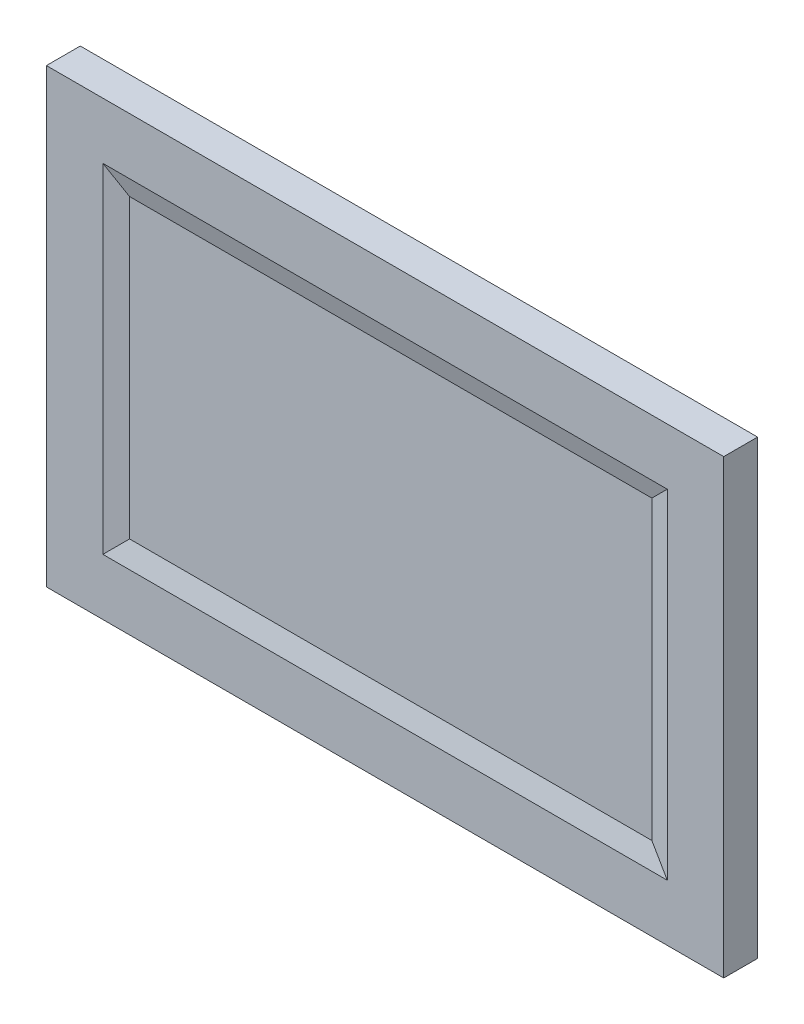
from build123d import *

# Parameters (mm, degrees)
SKETCH2_W                    = 120
SKETCH2_H                    = 80
BOSS_EXTRUDE1_DEPTH          = 3
SKETCH3_W                    = 100
SKETCH3_H                    = 60
CUT_EXTRUDE1_DEPTH           = 1
CUT_EXTRUDE1_TAPER           = 75
CUT_EXTRUDE1_OTHER_WAY_DEPTH = 1
CUT_EXTRUDE1_OTHER_WAY_DRAFT = -75
MIRROR1_COPY_1_SKETCH_W      = 100
MIRROR1_COPY_1_SKETCH_H      = 60
MIRROR1_COPY_1_DEPTH         = 1
MIRROR1_COPY_1_DRAFT         = -75
MIRROR1_COPY_2_SKETCH_W      = 100
MIRROR1_COPY_2_SKETCH_H      = 60
MIRROR1_COPY_2_DEPTH         = 1
MIRROR1_COPY_2_DRAFT         = -75
BOSS_EXTRUDE2_DEPTH          = 0.25


with BuildPart() as part:
    # Sketch2 → Boss-Extrude1 (new, symmetric)
    with BuildSketch(Plane.XY):
        Rectangle(SKETCH2_W, SKETCH2_H)
    extrude(amount=BOSS_EXTRUDE1_DEPTH, both=True)

    # Sketch3 → Cut-Extrude1 (cut)
    with BuildSketch(Plane.XY.offset(3)):
        Rectangle(SKETCH3_W, SKETCH3_H)
    cut_extrude1 = extrude(amount=CUT_EXTRUDE1_DEPTH, taper=CUT_EXTRUDE1_TAPER, mode=Mode.SUBTRACT)


with BuildPart() as cut_extrude1_other_way_tool:
    # Sketch3 → Cut-Extrude1 other way (with draft: the straight prism first)
    with BuildSketch(Plane.XY.offset(3)):
        Rectangle(SKETCH3_W, SKETCH3_H)
    extrude(amount=-CUT_EXTRUDE1_OTHER_WAY_DEPTH)
    # Cut-Extrude1 other way: the draft: its side faces are tilted about the plane it starts from
    cut_extrude1_other_way_sides = [cut_extrude1_other_way_tool.faces().sort_by_distance(p)[0] for p in [
        (-50, 0, 2.5),
        (0, -30, 2.5),
        (50, 0, 2.5),
        (0, 30, 2.5),
    ]]
    draft(cut_extrude1_other_way_sides, Plane.XY.offset(3), CUT_EXTRUDE1_OTHER_WAY_DRAFT)


with BuildPart() as part_1:
    add(part.part)

    # Cut-Extrude1 other way: cut by cut_extrude1_other_way_tool
    add(cut_extrude1_other_way_tool.part, mode=Mode.SUBTRACT)

    # Mirror1: Cut-Extrude1 across plane
    add(cut_extrude1.mirror(Plane.XY), mode=Mode.SUBTRACT)


with BuildPart() as mirror1_copy_1_tool:
    # Mirror1 copy 1 sketch → Mirror1 copy 1 (with draft: the straight prism first)
    with BuildSketch(Plane(origin=(0, 0, -3), x_dir=(1, 0, 0), z_dir=(0, 0, -1))):
        Rectangle(MIRROR1_COPY_1_SKETCH_W, MIRROR1_COPY_1_SKETCH_H)
    extrude(amount=-MIRROR1_COPY_1_DEPTH)
    # Mirror1 copy 1: the draft: its side faces are tilted about the plane it starts from
    mirror1_copy_1_sides = [mirror1_copy_1_tool.faces().sort_by_distance(p)[0] for p in [
        (-50, 0, -2.5),
        (0, -30, -2.5),
        (50, 0, -2.5),
        (0, 30, -2.5),
    ]]
    draft(mirror1_copy_1_sides, Plane(origin=(0, 0, -3), x_dir=(1, 0, 0), z_dir=(0, 0, -1)), MIRROR1_COPY_1_DRAFT)


with BuildPart() as part_2:
    add(part_1.part)

    # Mirror1 copy 1: cut by mirror1_copy_1_tool
    add(mirror1_copy_1_tool.part, mode=Mode.SUBTRACT)


with BuildPart() as mirror1_copy_2_tool:
    # Mirror1 copy 2 sketch → Mirror1 copy 2 (with draft: the straight prism first)
    with BuildSketch(Plane(origin=(0, 0, -3), x_dir=(1, 0, 0), z_dir=(0, 0, -1))):
        Rectangle(MIRROR1_COPY_2_SKETCH_W, MIRROR1_COPY_2_SKETCH_H)
    extrude(amount=-MIRROR1_COPY_2_DEPTH)
    # Mirror1 copy 2: the draft: its side faces are tilted about the plane it starts from
    mirror1_copy_2_sides = [mirror1_copy_2_tool.faces().sort_by_distance(p)[0] for p in [
        (-50, 0, -2.5),
        (0, -30, -2.5),
        (50, 0, -2.5),
        (0, 30, -2.5),
    ]]
    draft(mirror1_copy_2_sides, Plane(origin=(0, 0, -3), x_dir=(1, 0, 0), z_dir=(0, 0, -1)), MIRROR1_COPY_2_DRAFT)


with BuildPart() as part_3:
    add(part_2.part)

    # Mirror1 copy 2: cut by mirror1_copy_2_tool
    add(mirror1_copy_2_tool.part, mode=Mode.SUBTRACT)

    # Sketch4 → Boss-Extrude2 (add, symmetric)
    # profile 1 of 6: a face of its own
    with BuildSketch(Plane(origin=(0, 0, -2), x_dir=(-1, 0, 0), z_dir=(0, 0, -1))):
        Polygon((-41.003516665, -22.017655774), (-41.003516665, -18.517655774), (-40.937611216, -18.517655774), (-38.625311537, -21.272363306), (-38.625311537, -18.517655774), (-38.311208973, -18.517655774), (-38.311208973, -22.017655774), (-38.382723396, -22.017655774), (-40.689414101, -19.269258338), (-40.689414101, -22.017655774), align=None)
    # profile 2 of 6: a face of its own
    with BuildSketch(Plane(origin=(0, 0, -2), x_dir=(-1, 0, 0), z_dir=(0, 0, -1))):
        with BuildLine():
            add(Edge.make_bspline(
                [(-36.268140062, -19.415091671), (-36.22014879, -19.416113563), (-36.126049632, -19.418117241), (-35.988241746, -19.439532207), (-35.85669661, -19.472279571), (-35.730910418, -19.517551133), (-35.612494123, -19.578233084), (-35.499722878, -19.650642375), (-35.39290587, -19.736424969), (-35.32888284, -19.802783037), (-35.296385255, -19.83646587)],
                knots=[0, 0, 0, 0, 1.054011418, 2.066658804, 3.057071809, 4.030435133, 4.997543892, 5.974964718, 6.972108034, 8, 8, 8, 8], degree=3))
            add(Edge.make_bspline(
                [(-35.296385255, -19.83646587), (-35.268403301, -19.868679856), (-35.21298092, -19.932484398), (-35.141915202, -20.035940011), (-35.080693641, -20.143080112), (-35.03163068, -20.255327438), (-34.992945657, -20.37170211), (-34.965479961, -20.492604121), (-34.949143026, -20.617766468), (-34.946940059, -20.702770306), (-34.945824357, -20.745820838)],
                knots=[0, 0, 0, 0, 1.025258237, 2.030674902, 3.01204498, 3.988269485, 4.97094183, 5.956517959, 6.965070386, 8, 8, 8, 8], degree=3))
            add(Edge.make_bspline(
                [(-34.945824357, -20.745820838), (-34.946805695, -20.789120896), (-34.948744863, -20.874683829), (-34.967088479, -21.000703195), (-34.995619565, -21.122898018), (-35.036451403, -21.240756711), (-35.088809513, -21.354639539), (-35.1527002, -21.464049088), (-35.228571817, -21.569201221), (-35.314575814, -21.66920306), (-35.40962769, -21.761369274), (-35.512743838, -21.841697544), (-35.621897872, -21.910519068), (-35.738541226, -21.965955484), (-35.861608712, -22.009665184), (-35.99136578, -22.040365201), (-36.127610851, -22.058926884), (-36.220638072, -22.061310458), (-36.268140062, -22.062527569)],
                knots=[0, 0, 0, 0, 0.998656419, 1.973391657, 2.932242238, 3.890759089, 4.846373663, 5.82037756, 6.809684879, 7.83454468, 8.860553229, 9.859544525, 10.845671541, 11.83227036, 12.833544569, 13.85385346, 14.904124723, 16, 16, 16, 16], degree=3))
            add(Edge.make_bspline(
                [(-36.268140062, -22.062527569), (-36.315874782, -22.061306373), (-36.409365642, -22.058914598), (-36.546091624, -22.040437315), (-36.676081242, -22.009679333), (-36.799309841, -21.96581184), (-36.916454688, -21.910517296), (-37.026241185, -21.841905607), (-37.1294411, -21.761345452), (-37.224513085, -21.669209515), (-37.31051169, -21.569199558), (-37.386384699, -21.46404952), (-37.450275025, -21.354639426), (-37.502633229, -21.240756741), (-37.543465041, -21.12289801), (-37.571996134, -21.000703197), (-37.590339749, -20.874683829), (-37.592278917, -20.789120896), (-37.593260255, -20.745820838)],
                knots=[0, 0, 0, 0, 1.099876186, 2.154163076, 3.173186993, 4.173200201, 5.163417411, 6.152872554, 7.150605724, 8.17532212, 9.198891216, 10.186952605, 11.159729845, 12.11414092, 13.071450619, 14.029093627, 15.002601286, 16, 16, 16, 16], degree=3))
            add(Edge.make_bspline(
                [(-37.593260255, -20.745820838), (-37.592136944, -20.703004292), (-37.589912983, -20.61823489), (-37.573592474, -20.493307829), (-37.546233917, -20.37261044), (-37.507502521, -20.256684964), (-37.45798733, -20.144929528), (-37.397626042, -20.037524697), (-37.325835409, -19.934536897), (-37.270633458, -19.870814817), (-37.242699357, -19.838569236)],
                knots=[0, 0, 0, 0, 1.031353054, 2.041901799, 3.029428768, 4.008703097, 4.981709435, 5.96992636, 6.972712378, 8, 8, 8, 8], degree=3))
            add(Edge.make_bspline(
                [(-37.242699357, -19.838569236), (-37.210250766, -19.804594296), (-37.146434902, -19.7377766), (-37.039086175, -19.652244076), (-36.926592354, -19.578328002), (-36.806867427, -19.518851787), (-36.681184569, -19.472013269), (-36.548965327, -19.439447754), (-36.410689811, -19.418194399), (-36.31613019, -19.416136221), (-36.268140062, -19.415091671)],
                knots=[0, 0, 0, 0, 1.027980169, 2.021703884, 2.998553061, 3.971491411, 4.943284454, 5.930300938, 6.949603206, 8, 8, 8, 8], degree=3))
        make_face()
        with BuildLine():
            add(Edge.make_bspline(
                [(-36.269542306, -19.729194236), (-36.303479917, -19.730158827), (-36.370479046, -19.73206311), (-36.469098631, -19.746547015), (-36.564038785, -19.769494519), (-36.655479629, -19.802098575), (-36.743112801, -19.844197474), (-36.827022204, -19.895905834), (-36.907454643, -19.95653879), (-36.982836707, -20.026001462), (-37.052019019, -20.101880457), (-37.112496996, -20.182728815), (-37.163922102, -20.267235162), (-37.206762261, -20.355487373), (-37.238669449, -20.448379787), (-37.261842471, -20.544860418), (-37.276312712, -20.645125834), (-37.278199091, -20.713286853), (-37.279157691, -20.747924204)],
                knots=[0, 0, 0, 0, 1.021534396, 2.016698045, 2.994645724, 3.958388632, 4.93408049, 5.916473867, 6.921342795, 7.962252576, 8.998418191, 10.008913653, 10.997312074, 11.973003931, 12.956656626, 13.948281152, 14.957379055, 16, 16, 16, 16], degree=3))
            add(Edge.make_bspline(
                [(-37.279157691, -20.747924204), (-37.277550867, -20.792676231), (-37.274361622, -20.881500636), (-37.248426386, -21.012311759), (-37.205040106, -21.137893611), (-37.146452826, -21.257509997), (-37.073046608, -21.368182275), (-36.986559541, -21.466853759), (-36.887919841, -21.552039571), (-36.778303341, -21.622720416), (-36.659949023, -21.678880172), (-36.534692702, -21.718679148), (-36.404052007, -21.74455084), (-36.314771276, -21.747122315), (-36.269542306, -21.748425005)],
                knots=[0, 0, 0, 0, 1.016792936, 2.018143844, 3.017858371, 4.030088057, 5.03801393, 6.028138512, 7.003788237, 7.991172063, 8.984598303, 9.972568034, 10.972917682, 12, 12, 12, 12], degree=3))
            add(Edge.make_bspline(
                [(-36.269542306, -21.748425005), (-36.224315937, -21.747114725), (-36.135040341, -21.744528268), (-36.004581164, -21.718809448), (-35.879667192, -21.678705787), (-35.761435805, -21.622783577), (-35.651869201, -21.551771163), (-35.55252008, -21.467334786), (-35.466771469, -21.367920934), (-35.393437864, -21.257363405), (-35.333891121, -21.138079053), (-35.29070792, -21.012288581), (-35.264710334, -20.881506539), (-35.261529505, -20.792678208), (-35.259926921, -20.747924204)],
                knots=[0, 0, 0, 0, 1.02726834, 2.027799167, 3.010890988, 4.004497153, 4.992059811, 5.971914811, 6.958719428, 7.966827853, 8.981595046, 9.981490638, 10.983022906, 12, 12, 12, 12], degree=3))
            add(Edge.make_bspline(
                [(-35.259926921, -20.747924204), (-35.260885191, -20.713286646), (-35.26277092, -20.64512522), (-35.277245885, -20.544862767), (-35.300401425, -20.44837117), (-35.332373042, -20.355519167), (-35.375027056, -20.267006662), (-35.427443849, -20.182976935), (-35.487674874, -20.101600389), (-35.557691995, -20.026246748), (-35.632995373, -19.956511712), (-35.713460411, -19.895882322), (-35.79724539, -19.844424727), (-35.884623972, -19.801738486), (-35.97607654, -19.769791146), (-36.070883669, -19.746414515), (-36.169082479, -19.732124318), (-36.235841522, -19.730177176), (-36.269542306, -19.729194236)],
                knots=[0, 0, 0, 0, 1.042956736, 2.052379634, 3.044323526, 4.02829302, 5.004299113, 5.996692471, 7.007513377, 8.048758398, 9.090003419, 10.095195979, 11.07790575, 12.047570684, 13.018257071, 13.989683339, 14.985167495, 16, 16, 16, 16], degree=3))
        make_face(mode=Mode.SUBTRACT)
    # profile 3 of 6: a face of its own
    with BuildSketch(Plane(origin=(0, 0, -2), x_dir=(-1, 0, 0), z_dir=(0, 0, -1))):
        with BuildLine():
            Line((-32.971465383, -18.427912184), (-32.657362819, -18.427912184))
            Line((-32.657362819, -18.427912184), (-32.657362819, -19.943036383))
            add(Edge.make_bspline(
                [(-32.657362819, -19.943036383), (-32.623645517, -19.900892401), (-32.557996203, -19.818835908), (-32.447500086, -19.711774717), (-32.334029214, -19.618976096), (-32.213664405, -19.545105639), (-32.088613884, -19.486749096), (-31.95835024, -19.445361449), (-31.822849268, -19.419910353), (-31.730824118, -19.416711935), (-31.684205768, -19.415091671)],
                knots=[0, 0, 0, 0, 1.125788106, 2.19196713, 3.20547328, 4.180437432, 5.132270164, 6.079753143, 7.027236121, 8, 8, 8, 8], degree=3))
            add(Edge.make_bspline(
                [(-31.684205768, -19.415091671), (-31.636875375, -19.416837102), (-31.544238379, -19.42025333), (-31.409356917, -19.447266711), (-31.283396042, -19.493424149), (-31.166730199, -19.556591174), (-31.061905502, -19.635264001), (-30.969055737, -19.726095524), (-30.893214939, -19.831369442), (-30.841615822, -19.928625696), (-30.808042414, -20.01516445), (-30.786790588, -20.089400962), (-30.768771389, -20.172122875), (-30.753071653, -20.263287608), (-30.742608072, -20.363332779), (-30.734203454, -20.471807034), (-30.728227, -20.588704152), (-30.727995395, -20.669624401), (-30.727875639, -20.71146587)],
                knots=[0, 0, 0, 0, 1.235656852, 2.418478516, 3.575258207, 4.727955599, 5.870717718, 6.98870536, 8.107142894, 9.245821548, 9.854588956, 10.528768408, 11.260415777, 12.065282286, 12.943670737, 13.886611085, 14.907229059, 16, 16, 16, 16], degree=3))
            Line((-30.727875639, -20.71146587), (-30.727875639, -22.017655774))
            Line((-30.727875639, -22.017655774), (-31.041978203, -22.017655774))
            Line((-31.041978203, -22.017655774), (-31.041978203, -20.814530774))
            add(Edge.make_bspline(
                [(-31.041978203, -20.814530774), (-31.042168507, -20.779708104), (-31.042532524, -20.713098264), (-31.043735869, -20.617732156), (-31.046422084, -20.531236021), (-31.05076291, -20.453887069), (-31.055328217, -20.385577466), (-31.061611534, -20.326406412), (-31.068921768, -20.276292636), (-31.07549055, -20.246128008), (-31.078436537, -20.232599684)],
                knots=[0, 0, 0, 0, 1.430932559, 2.737130458, 3.918967929, 4.986496826, 5.920444988, 6.731744033, 7.431208747, 8, 8, 8, 8], degree=3))
            add(Edge.make_bspline(
                [(-31.078436537, -20.232599684), (-31.089860782, -20.192905421), (-31.111823826, -20.11659343), (-31.162871804, -20.01293102), (-31.226630815, -19.924546279), (-31.304478076, -19.852631991), (-31.39503644, -19.796220452), (-31.498896405, -19.757152669), (-31.615080473, -19.732904947), (-31.696931945, -19.730465644), (-31.739594389, -19.729194236)],
                knots=[0, 0, 0, 0, 1.090059168, 2.095632401, 3.037101401, 3.955032261, 4.878929692, 5.839099886, 6.873700383, 8, 8, 8, 8], degree=3))
            add(Edge.make_bspline(
                [(-31.739594389, -19.729194236), (-31.764862162, -19.729670062), (-31.814866433, -19.73061171), (-31.889015099, -19.740065608), (-31.960944162, -19.755514327), (-32.03134634, -19.776418866), (-32.098729538, -19.804864402), (-32.165057863, -19.837794592), (-32.228452072, -19.878102846), (-32.290037888, -19.923328614), (-32.347355422, -19.973398374), (-32.400682537, -20.026245329), (-32.448220877, -20.082520293), (-32.491289468, -20.141320409), (-32.528467754, -20.203452202), (-32.560920836, -20.268316521), (-32.588456533, -20.335998666), (-32.602139225, -20.382973728), (-32.608985415, -20.406477889)],
                knots=[0, 0, 0, 0, 1.024319606, 2.027102035, 3.025350316, 4.005802111, 5.00026367, 5.987881639, 7.005602596, 8.042517216, 9.083927026, 10.089214625, 11.084353441, 12.06828073, 13.041928858, 14.016821737, 15.00770877, 16, 16, 16, 16], degree=3))
            add(Edge.make_bspline(
                [(-32.608985415, -20.406477889), (-32.612924842, -20.42349884), (-32.621509339, -20.460589587), (-32.630824172, -20.521763911), (-32.639161969, -20.592850283), (-32.646210519, -20.673740884), (-32.650533605, -20.764732126), (-32.655191846, -20.865203085), (-32.65692586, -20.975783106), (-32.657212813, -21.052678613), (-32.657362819, -21.092876127)],
                knots=[0, 0, 0, 0, 0.607992626, 1.324890765, 2.152360218, 3.099583803, 4.150613268, 5.323148443, 6.60066238, 8, 8, 8, 8], degree=3))
            Line((-32.657362819, -21.092876127), (-32.657362819, -22.017655774))
            Line((-32.657362819, -22.017655774), (-32.971465383, -22.017655774))
            Line((-32.971465383, -22.017655774), (-32.971465383, -18.427912184))
        make_face()
    # profile 4 of 6: a face of its own
    with BuildSketch(Plane(origin=(0, 0, -2), x_dir=(-1, 0, 0), z_dir=(0, 0, -1))):
        with BuildLine():
            add(Edge.make_bspline(
                [(-28.774550319, -19.415091671), (-28.726559046, -19.416113563), (-28.632459888, -19.418117241), (-28.494652002, -19.439532207), (-28.363106867, -19.472279571), (-28.237320674, -19.517551133), (-28.118904379, -19.578233084), (-28.006133135, -19.650642375), (-27.899316126, -19.736424969), (-27.835293097, -19.802783037), (-27.802795511, -19.83646587)],
                knots=[0, 0, 0, 0, 1.054011418, 2.066658804, 3.057071809, 4.030435133, 4.997543892, 5.974964718, 6.972108034, 8, 8, 8, 8], degree=3))
            add(Edge.make_bspline(
                [(-27.802795511, -19.83646587), (-27.774813557, -19.868679856), (-27.719391177, -19.932484398), (-27.648325458, -20.035940011), (-27.587103898, -20.143080112), (-27.538040937, -20.255327438), (-27.499355913, -20.37170211), (-27.471890217, -20.492604121), (-27.455553282, -20.617766468), (-27.453350315, -20.702770306), (-27.452234614, -20.745820838)],
                knots=[0, 0, 0, 0, 1.025258237, 2.030674902, 3.01204498, 3.988269485, 4.97094183, 5.956517959, 6.965070386, 8, 8, 8, 8], degree=3))
            add(Edge.make_bspline(
                [(-27.452234614, -20.745820838), (-27.453215951, -20.789120896), (-27.455155119, -20.874683829), (-27.473498736, -21.000703195), (-27.502029822, -21.122898018), (-27.54286166, -21.240756711), (-27.595219769, -21.354639539), (-27.659110457, -21.464049088), (-27.734982074, -21.569201221), (-27.82098607, -21.66920306), (-27.916037947, -21.761369274), (-28.019154095, -21.841697544), (-28.128308129, -21.910519068), (-28.244951482, -21.965955484), (-28.368018969, -22.009665184), (-28.497776037, -22.040365201), (-28.634021107, -22.058926884), (-28.727048329, -22.061310458), (-28.774550319, -22.062527569)],
                knots=[0, 0, 0, 0, 0.998656419, 1.973391657, 2.932242238, 3.890759089, 4.846373663, 5.82037756, 6.809684879, 7.83454468, 8.860553229, 9.859544525, 10.845671541, 11.83227036, 12.833544569, 13.85385346, 14.904124723, 16, 16, 16, 16], degree=3))
            add(Edge.make_bspline(
                [(-28.774550319, -22.062527569), (-28.822285038, -22.061306373), (-28.915775898, -22.058914598), (-29.05250188, -22.040437315), (-29.182491499, -22.009679333), (-29.305720097, -21.96581184), (-29.422864944, -21.910517296), (-29.532651441, -21.841905607), (-29.635851357, -21.761345452), (-29.730923341, -21.669209515), (-29.816921947, -21.569199558), (-29.892794955, -21.46404952), (-29.956685281, -21.354639426), (-30.009043485, -21.240756741), (-30.049875298, -21.12289801), (-30.078406391, -21.000703197), (-30.096750005, -20.874683829), (-30.098689174, -20.789120896), (-30.099670511, -20.745820838)],
                knots=[0, 0, 0, 0, 1.099876186, 2.154163076, 3.173186993, 4.173200201, 5.163417411, 6.152872554, 7.150605724, 8.17532212, 9.198891216, 10.186952605, 11.159729845, 12.11414092, 13.071450619, 14.029093627, 15.002601286, 16, 16, 16, 16], degree=3))
            add(Edge.make_bspline(
                [(-30.099670511, -20.745820838), (-30.098547201, -20.703004292), (-30.096323239, -20.61823489), (-30.08000273, -20.493307829), (-30.052644174, -20.37261044), (-30.013912777, -20.256684964), (-29.964397586, -20.144929528), (-29.904036298, -20.037524697), (-29.832245666, -19.934536897), (-29.777043714, -19.870814817), (-29.749109614, -19.838569236)],
                knots=[0, 0, 0, 0, 1.031353054, 2.041901799, 3.029428768, 4.008703097, 4.981709435, 5.96992636, 6.972712378, 8, 8, 8, 8], degree=3))
            add(Edge.make_bspline(
                [(-29.749109614, -19.838569236), (-29.716661023, -19.804594296), (-29.652845159, -19.7377766), (-29.545496431, -19.652244076), (-29.43300261, -19.578328002), (-29.313277684, -19.518851787), (-29.187594826, -19.472013269), (-29.055375583, -19.439447754), (-28.917100068, -19.418194399), (-28.822540447, -19.416136221), (-28.774550319, -19.415091671)],
                knots=[0, 0, 0, 0, 1.027980169, 2.021703884, 2.998553061, 3.971491411, 4.943284454, 5.930300938, 6.949603206, 8, 8, 8, 8], degree=3))
        make_face()
        with BuildLine():
            add(Edge.make_bspline(
                [(-28.775952562, -19.729194236), (-28.809890174, -19.730158827), (-28.876889302, -19.73206311), (-28.975508887, -19.746547015), (-29.070449041, -19.769494519), (-29.161889885, -19.802098575), (-29.249523058, -19.844197474), (-29.33343246, -19.895905834), (-29.4138649, -19.95653879), (-29.489246963, -20.026001462), (-29.558429275, -20.101880457), (-29.618907252, -20.182728815), (-29.670332358, -20.267235162), (-29.713172517, -20.355487373), (-29.745079705, -20.448379787), (-29.768252728, -20.544860418), (-29.782722968, -20.645125834), (-29.784609347, -20.713286853), (-29.785567947, -20.747924204)],
                knots=[0, 0, 0, 0, 1.021534396, 2.016698045, 2.994645724, 3.958388632, 4.93408049, 5.916473867, 6.921342795, 7.962252576, 8.998418191, 10.008913653, 10.997312074, 11.973003931, 12.956656626, 13.948281152, 14.957379055, 16, 16, 16, 16], degree=3))
            add(Edge.make_bspline(
                [(-29.785567947, -20.747924204), (-29.783961123, -20.792676231), (-29.780771879, -20.881500636), (-29.754836642, -21.012311759), (-29.711450363, -21.137893611), (-29.652863083, -21.257509997), (-29.579456864, -21.368182275), (-29.492969798, -21.466853759), (-29.394330097, -21.552039571), (-29.284713597, -21.622720416), (-29.166359279, -21.678880172), (-29.041102958, -21.718679148), (-28.910462264, -21.74455084), (-28.821181533, -21.747122315), (-28.775952562, -21.748425005)],
                knots=[0, 0, 0, 0, 1.016792936, 2.018143844, 3.017858371, 4.030088057, 5.03801393, 6.028138512, 7.003788237, 7.991172063, 8.984598303, 9.972568034, 10.972917682, 12, 12, 12, 12], degree=3))
            add(Edge.make_bspline(
                [(-28.775952562, -21.748425005), (-28.730726193, -21.747114725), (-28.641450597, -21.744528268), (-28.510991421, -21.718809448), (-28.386077449, -21.678705787), (-28.267846061, -21.622783577), (-28.158279458, -21.551771163), (-28.058930336, -21.467334786), (-27.973181725, -21.367920934), (-27.89984812, -21.257363405), (-27.840301378, -21.138079053), (-27.797118176, -21.012288581), (-27.77112059, -20.881506539), (-27.767939761, -20.792678208), (-27.766337178, -20.747924204)],
                knots=[0, 0, 0, 0, 1.02726834, 2.027799167, 3.010890988, 4.004497153, 4.992059811, 5.971914811, 6.958719428, 7.966827853, 8.981595046, 9.981490638, 10.983022906, 12, 12, 12, 12], degree=3))
            add(Edge.make_bspline(
                [(-27.766337178, -20.747924204), (-27.767295448, -20.713286646), (-27.769181177, -20.64512522), (-27.783656141, -20.544862767), (-27.806811681, -20.44837117), (-27.838783298, -20.355519167), (-27.881437312, -20.267006662), (-27.933854105, -20.182976935), (-27.994085131, -20.101600389), (-28.064102251, -20.026246748), (-28.139405629, -19.956511712), (-28.219870667, -19.895882322), (-28.303655646, -19.844424727), (-28.391034229, -19.801738486), (-28.482486796, -19.769791146), (-28.577293926, -19.746414515), (-28.675492736, -19.732124318), (-28.742251779, -19.730177176), (-28.775952562, -19.729194236)],
                knots=[0, 0, 0, 0, 1.042956736, 2.052379634, 3.044323526, 4.02829302, 5.004299113, 5.996692471, 7.007513377, 8.048758398, 9.090003419, 10.095195979, 11.07790575, 12.047570684, 13.018257071, 13.989683339, 14.985167495, 16, 16, 16, 16], degree=3))
        make_face(mode=Mode.SUBTRACT)
    # profile 5 of 6: a face of its own
    with BuildSketch(Plane(origin=(0, 0, -2), x_dir=(-1, 0, 0), z_dir=(0, 0, -1))):
        with BuildLine():
            Line((-26.824029485, -19.459963466), (-26.509926921, -19.459963466))
            Line((-26.509926921, -19.459963466), (-26.509926921, -19.904474684))
            add(Edge.make_bspline(
                [(-26.509926921, -19.904474684), (-26.481642971, -19.865587083), (-26.427448212, -19.791074709), (-26.338582559, -19.692884425), (-26.249806447, -19.609556271), (-26.185873065, -19.565813399), (-26.155159293, -19.544799204)],
                knots=[0, 0, 0, 0, 1.134379233, 2.173579362, 3.122582517, 4, 4, 4, 4], degree=3))
            add(Edge.make_bspline(
                [(-26.155159293, -19.544799204), (-26.113294631, -19.524793838), (-26.030296731, -19.485132625), (-25.898877506, -19.444899066), (-25.764402837, -19.420173965), (-25.673594623, -19.416792591), (-25.627915703, -19.415091671)],
                knots=[0, 0, 0, 0, 1.014936303, 2.012140481, 3.000054389, 4, 4, 4, 4], degree=3))
            add(Edge.make_bspline(
                [(-25.627915703, -19.415091671), (-25.597022707, -19.416136962), (-25.535887128, -19.418205536), (-25.445303038, -19.431665572), (-25.357444426, -19.454931745), (-25.272830397, -19.487339069), (-25.193109717, -19.526585756), (-25.12002052, -19.572635463), (-25.054396311, -19.624332539), (-24.99627026, -19.684011472), (-24.944001235, -19.75334807), (-24.895922388, -19.834212319), (-24.851497176, -19.92841998), (-24.826875867, -19.996786521), (-24.8139133, -20.032779973)],
                knots=[0, 0, 0, 0, 1.009824226, 1.998387844, 2.986035974, 3.974953746, 4.955485308, 5.885931332, 6.793869504, 7.679848016, 8.601185859, 9.625726857, 10.749998409, 12, 12, 12, 12], degree=3))
            add(Edge.make_bspline(
                [(-24.8139133, -20.032779973), (-24.800202048, -20.008055553), (-24.773220231, -19.959401369), (-24.727914594, -19.890543106), (-24.680446798, -19.826136314), (-24.630412304, -19.76612989), (-24.577987718, -19.71082016), (-24.522926317, -19.660024258), (-24.465541536, -19.613524044), (-24.385749296, -19.559200885), (-24.281936689, -19.501499703), (-24.151048574, -19.451471259), (-24.014898402, -19.420555131), (-23.922480704, -19.416924858), (-23.875812338, -19.415091671)],
                knots=[0, 0, 0, 0, 0.86119277, 1.694706429, 2.50939023, 3.298075842, 4.073795165, 4.829715201, 5.57930267, 6.321991688, 7.768977793, 9.186738141, 10.579381044, 12, 12, 12, 12], degree=3))
            add(Edge.make_bspline(
                [(-23.875812338, -19.415091671), (-23.832930875, -19.416708892), (-23.749007689, -19.419873951), (-23.626830423, -19.444727424), (-23.512888618, -19.487405071), (-23.407411542, -19.545638708), (-23.312251728, -19.618817891), (-23.229535419, -19.705886729), (-23.159765056, -19.806229352), (-23.114186416, -19.90062134), (-23.083271152, -19.983956673), (-23.064209918, -20.054962964), (-23.047370223, -20.133114517), (-23.033388977, -20.218504779), (-23.023170425, -20.311435387), (-23.01559971, -20.411754263), (-23.010475636, -20.519539375), (-23.010113564, -20.593904875), (-23.009926921, -20.632239107)],
                knots=[0, 0, 0, 0, 1.209669288, 2.367440248, 3.500751976, 4.631527125, 5.755587489, 6.87532382, 8.007944318, 9.190864318, 9.82315674, 10.514484317, 11.263564316, 12.079023757, 12.955305781, 13.901327259, 14.918167583, 16, 16, 16, 16], degree=3))
            Line((-23.009926921, -20.632239107), (-23.009926921, -22.017655774))
            Line((-23.009926921, -22.017655774), (-23.324029485, -22.017655774))
            Line((-23.324029485, -22.017655774), (-23.324029485, -20.630836864))
            add(Edge.make_bspline(
                [(-23.324029485, -20.630836864), (-23.324107368, -20.59811629), (-23.324257048, -20.535232323), (-23.326950679, -20.444979872), (-23.332025993, -20.362711515), (-23.337960632, -20.288539426), (-23.346204441, -20.222290638), (-23.356850373, -20.164098219), (-23.368128053, -20.113504408), (-23.386864044, -20.05741836), (-23.416811936, -19.99554815), (-23.462429416, -19.928824574), (-23.519899522, -19.870743774), (-23.586259679, -19.820325457), (-23.661808123, -19.779331816), (-23.745072847, -19.750055806), (-23.835536898, -19.731932928), (-23.898159687, -19.730126912), (-23.930499838, -19.729194236)],
                knots=[0, 0, 0, 0, 1.253487763, 2.409012846, 3.458416907, 4.410876679, 5.259312806, 6.014470957, 6.676830364, 7.243083969, 8.276244668, 9.299465089, 10.325150304, 11.392391894, 12.482080715, 13.603491619, 14.762376348, 16, 16, 16, 16], degree=3))
            add(Edge.make_bspline(
                [(-23.930499838, -19.729194236), (-23.970169792, -19.730610393), (-24.048572704, -19.733409258), (-24.16301819, -19.761983131), (-24.272989206, -19.805063382), (-24.375204339, -19.867495839), (-24.46923213, -19.942304203), (-24.550131708, -20.031253799), (-24.616963893, -20.131883726), (-24.662217869, -20.225030428), (-24.690807171, -20.308699872), (-24.709684086, -20.381797244), (-24.724367478, -20.464878812), (-24.738138007, -20.557386303), (-24.747125735, -20.659956483), (-24.755294107, -20.772114884), (-24.75911497, -20.894198843), (-24.759649429, -20.978825532), (-24.759926921, -21.022763947)],
                knots=[0, 0, 0, 0, 1.090531906, 2.155305635, 3.229839962, 4.33261226, 5.44038871, 6.529323825, 7.629011124, 8.757537029, 9.370236727, 10.061839251, 10.834451254, 11.692844982, 12.636905849, 13.66920014, 14.789842145, 16, 16, 16, 16], degree=3))
            Line((-24.759926921, -21.022763947), (-24.759926921, -22.017655774))
            Line((-24.759926921, -22.017655774), (-25.074029485, -22.017655774))
            Line((-25.074029485, -22.017655774), (-25.074029485, -20.717074845))
            add(Edge.make_bspline(
                [(-25.074029485, -20.717074845), (-25.074108916, -20.680381526), (-25.074261734, -20.609787269), (-25.076938051, -20.508553593), (-25.082024673, -20.416472513), (-25.087905221, -20.333651049), (-25.0963654, -20.260239721), (-25.105975162, -20.195844963), (-25.117323772, -20.140628212), (-25.136113657, -20.080064827), (-25.164828125, -20.013343904), (-25.211016387, -19.942202882), (-25.268623967, -19.879934785), (-25.336194843, -19.826776037), (-25.412200526, -19.782834555), (-25.496183926, -19.751174803), (-25.587388839, -19.732750514), (-25.650266545, -19.730402017), (-25.682603203, -19.729194236)],
                knots=[0, 0, 0, 0, 1.320475261, 2.540461679, 3.643808994, 4.639130445, 5.527981419, 6.302341397, 6.981980563, 7.553956391, 8.582137848, 9.585246428, 10.591171744, 11.620968678, 12.668337649, 13.738356861, 14.836885341, 16, 16, 16, 16], degree=3))
            add(Edge.make_bspline(
                [(-25.682603203, -19.729194236), (-25.720619415, -19.730724696), (-25.796384374, -19.733774848), (-25.907686344, -19.761229122), (-26.015172028, -19.804233197), (-26.117126726, -19.863893016), (-26.210800875, -19.937792094), (-26.292809142, -20.02470699), (-26.361751667, -20.123556024), (-26.407483482, -20.21572054), (-26.436981956, -20.297293815), (-26.456577291, -20.366644763), (-26.473416917, -20.443645011), (-26.485930939, -20.528532122), (-26.498011354, -20.620753216), (-26.503841663, -20.720767706), (-26.509513226, -20.828489794), (-26.50978564, -20.902862339), (-26.509926921, -20.941433819)],
                knots=[0, 0, 0, 0, 1.098833095, 2.189935336, 3.297829714, 4.440610912, 5.596351641, 6.740013378, 7.886572111, 9.072425424, 9.705826452, 10.395263256, 11.156850408, 11.985370555, 12.878090359, 13.847760091, 14.883794034, 16, 16, 16, 16], degree=3))
            Line((-26.509926921, -20.941433819), (-26.509926921, -22.017655774))
            Line((-26.509926921, -22.017655774), (-26.824029485, -22.017655774))
            Line((-26.824029485, -22.017655774), (-26.824029485, -19.459963466))
        make_face()
    # profile 6 of 6: a face of its own
    with BuildSketch(Plane(origin=(0, 0, -2), x_dir=(-1, 0, 0), z_dir=(0, 0, -1))):
        with BuildLine():
            add(Edge.make_bspline(
                [(-21.056601601, -19.415091671), (-21.008610328, -19.416113563), (-20.91451117, -19.418117241), (-20.776703285, -19.439532207), (-20.645158149, -19.472279571), (-20.519371956, -19.517551133), (-20.400955661, -19.578233084), (-20.288184417, -19.650642375), (-20.181367408, -19.736424969), (-20.117344379, -19.802783037), (-20.084846793, -19.83646587)],
                knots=[0, 0, 0, 0, 1.054011418, 2.066658804, 3.057071809, 4.030435133, 4.997543892, 5.974964718, 6.972108034, 8, 8, 8, 8], degree=3))
            add(Edge.make_bspline(
                [(-20.084846793, -19.83646587), (-20.056864839, -19.868679856), (-20.001442459, -19.932484398), (-19.93037674, -20.035940011), (-19.86915518, -20.143080112), (-19.820092219, -20.255327438), (-19.781407195, -20.37170211), (-19.753941499, -20.492604121), (-19.737604564, -20.617766468), (-19.735401597, -20.702770306), (-19.734285896, -20.745820838)],
                knots=[0, 0, 0, 0, 1.025258237, 2.030674902, 3.01204498, 3.988269485, 4.97094183, 5.956517959, 6.965070386, 8, 8, 8, 8], degree=3))
            add(Edge.make_bspline(
                [(-19.734285896, -20.745820838), (-19.735267233, -20.789120896), (-19.737206401, -20.874683829), (-19.755550018, -21.000703195), (-19.784081104, -21.122898018), (-19.824912942, -21.240756711), (-19.877271051, -21.354639539), (-19.941161739, -21.464049088), (-20.017033356, -21.569201221), (-20.103037352, -21.66920306), (-20.198089229, -21.761369274), (-20.301205377, -21.841697544), (-20.410359411, -21.910519068), (-20.527002764, -21.965955484), (-20.650070251, -22.009665184), (-20.779827319, -22.040365201), (-20.916072389, -22.058926884), (-21.009099611, -22.061310458), (-21.056601601, -22.062527569)],
                knots=[0, 0, 0, 0, 0.998656419, 1.973391657, 2.932242238, 3.890759089, 4.846373663, 5.82037756, 6.809684879, 7.83454468, 8.860553229, 9.859544525, 10.845671541, 11.83227036, 12.833544569, 13.85385346, 14.904124723, 16, 16, 16, 16], degree=3))
            add(Edge.make_bspline(
                [(-21.056601601, -22.062527569), (-21.10433632, -22.061306373), (-21.19782718, -22.058914598), (-21.334553162, -22.040437315), (-21.464542781, -22.009679333), (-21.587771379, -21.96581184), (-21.704916226, -21.910517296), (-21.814702723, -21.841905607), (-21.917902639, -21.761345452), (-22.012974623, -21.669209515), (-22.098973229, -21.569199558), (-22.174846237, -21.46404952), (-22.238736563, -21.354639426), (-22.291094767, -21.240756741), (-22.33192658, -21.12289801), (-22.360457673, -21.000703197), (-22.378801287, -20.874683829), (-22.380740456, -20.789120896), (-22.381721793, -20.745820838)],
                knots=[0, 0, 0, 0, 1.099876186, 2.154163076, 3.173186993, 4.173200201, 5.163417411, 6.152872554, 7.150605724, 8.17532212, 9.198891216, 10.186952605, 11.159729845, 12.11414092, 13.071450619, 14.029093627, 15.002601286, 16, 16, 16, 16], degree=3))
            add(Edge.make_bspline(
                [(-22.381721793, -20.745820838), (-22.380598483, -20.703004292), (-22.378374521, -20.61823489), (-22.362054012, -20.493307829), (-22.334695456, -20.37261044), (-22.295964059, -20.256684964), (-22.246448868, -20.144929528), (-22.18608758, -20.037524697), (-22.114296948, -19.934536897), (-22.059094996, -19.870814817), (-22.031160896, -19.838569236)],
                knots=[0, 0, 0, 0, 1.031353054, 2.041901799, 3.029428768, 4.008703097, 4.981709435, 5.96992636, 6.972712378, 8, 8, 8, 8], degree=3))
            add(Edge.make_bspline(
                [(-22.031160896, -19.838569236), (-21.998712305, -19.804594296), (-21.934896441, -19.7377766), (-21.827547713, -19.652244076), (-21.715053892, -19.578328002), (-21.595328966, -19.518851787), (-21.469646108, -19.472013269), (-21.337426865, -19.439447754), (-21.19915135, -19.418194399), (-21.104591729, -19.416136221), (-21.056601601, -19.415091671)],
                knots=[0, 0, 0, 0, 1.027980169, 2.021703884, 2.998553061, 3.971491411, 4.943284454, 5.930300938, 6.949603206, 8, 8, 8, 8], degree=3))
        make_face()
        with BuildLine():
            add(Edge.make_bspline(
                [(-21.058003844, -19.729194236), (-21.091941456, -19.730158827), (-21.158940584, -19.73206311), (-21.257560169, -19.746547015), (-21.352500323, -19.769494519), (-21.443941167, -19.802098575), (-21.53157434, -19.844197474), (-21.615483742, -19.895905834), (-21.695916182, -19.95653879), (-21.771298245, -20.026001462), (-21.840480557, -20.101880457), (-21.900958534, -20.182728815), (-21.95238364, -20.267235162), (-21.995223799, -20.355487373), (-22.027130987, -20.448379787), (-22.05030401, -20.544860418), (-22.06477425, -20.645125834), (-22.066660629, -20.713286853), (-22.067619229, -20.747924204)],
                knots=[0, 0, 0, 0, 1.021534396, 2.016698045, 2.994645724, 3.958388632, 4.93408049, 5.916473867, 6.921342795, 7.962252576, 8.998418191, 10.008913653, 10.997312074, 11.973003931, 12.956656626, 13.948281152, 14.957379055, 16, 16, 16, 16], degree=3))
            add(Edge.make_bspline(
                [(-22.067619229, -20.747924204), (-22.066012405, -20.792676231), (-22.062823161, -20.881500636), (-22.036887925, -21.012311759), (-21.993501645, -21.137893611), (-21.934914365, -21.257509997), (-21.861508146, -21.368182275), (-21.77502108, -21.466853759), (-21.676381379, -21.552039571), (-21.566764879, -21.622720416), (-21.448410561, -21.678880172), (-21.32315424, -21.718679148), (-21.192513546, -21.74455084), (-21.103232815, -21.747122315), (-21.058003844, -21.748425005)],
                knots=[0, 0, 0, 0, 1.016792936, 2.018143844, 3.017858371, 4.030088057, 5.03801393, 6.028138512, 7.003788237, 7.991172063, 8.984598303, 9.972568034, 10.972917682, 12, 12, 12, 12], degree=3))
            add(Edge.make_bspline(
                [(-21.058003844, -21.748425005), (-21.012777475, -21.747114725), (-20.92350188, -21.744528268), (-20.793042703, -21.718809448), (-20.668128731, -21.678705787), (-20.549897343, -21.622783577), (-20.44033074, -21.551771163), (-20.340981619, -21.467334786), (-20.255233007, -21.367920934), (-20.181899403, -21.257363405), (-20.12235266, -21.138079053), (-20.079169458, -21.012288581), (-20.053171872, -20.881506539), (-20.049991043, -20.792678208), (-20.04838846, -20.747924204)],
                knots=[0, 0, 0, 0, 1.02726834, 2.027799167, 3.010890988, 4.004497153, 4.992059811, 5.971914811, 6.958719428, 7.966827853, 8.981595046, 9.981490638, 10.983022906, 12, 12, 12, 12], degree=3))
            add(Edge.make_bspline(
                [(-20.04838846, -20.747924204), (-20.04934673, -20.713286646), (-20.051232459, -20.64512522), (-20.065707423, -20.544862767), (-20.088862963, -20.44837117), (-20.12083458, -20.355519167), (-20.163488594, -20.267006662), (-20.215905387, -20.182976935), (-20.276136413, -20.101600389), (-20.346153533, -20.026246748), (-20.421456911, -19.956511712), (-20.50192195, -19.895882322), (-20.585706928, -19.844424727), (-20.673085511, -19.801738486), (-20.764538078, -19.769791146), (-20.859345208, -19.746414515), (-20.957544018, -19.732124318), (-21.024303061, -19.730177176), (-21.058003844, -19.729194236)],
                knots=[0, 0, 0, 0, 1.042956736, 2.052379634, 3.044323526, 4.02829302, 5.004299113, 5.996692471, 7.007513377, 8.048758398, 9.090003419, 10.095195979, 11.07790575, 12.047570684, 13.018257071, 13.989683339, 14.985167495, 16, 16, 16, 16], degree=3))
        make_face(mode=Mode.SUBTRACT)
    extrude(amount=BOSS_EXTRUDE2_DEPTH, both=True)


solid = part_3.part
